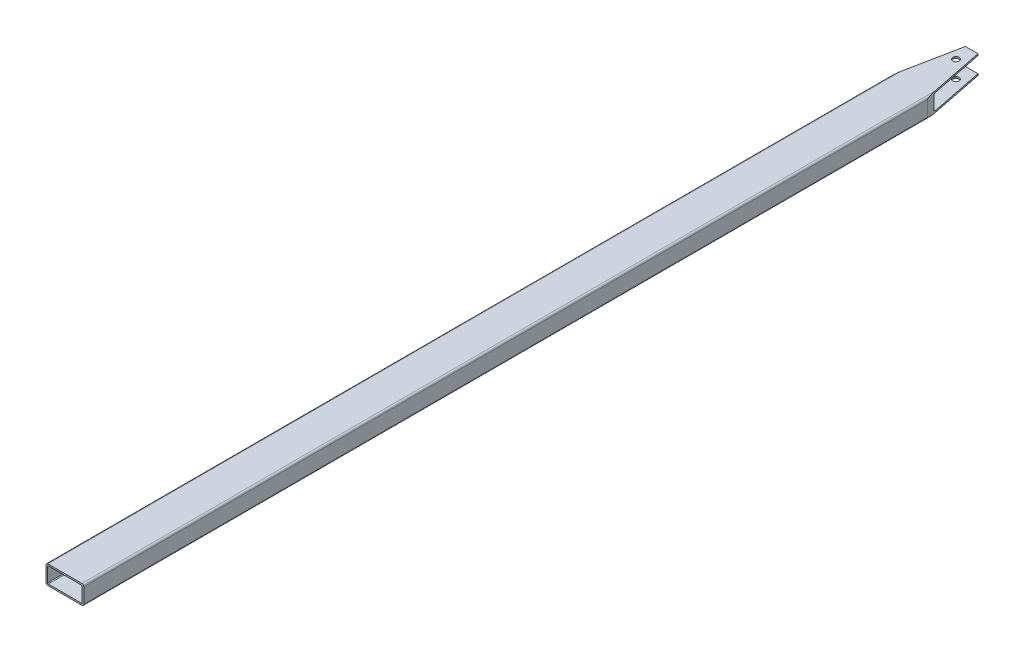
from build123d import *

# Parameters (mm, degrees)
BOSS_EXTRUDE1_DEPTH      = 914.4
BOSS_EXTRUDE1_DEPTH_BACK = 914.4
SKETCH7_R                = 6.35
CUT_EXTRUDE1_DEPTH       = 916.986124349


with BuildPart() as part:
    # Sketch4 → Boss-Extrude1 (new, two sides: drawn at the far end of the back side and taken through both)
    with BuildSketch(Plane.XY.offset(-BOSS_EXTRUDE1_DEPTH_BACK)):
        with BuildLine():
            Line((38.1, -15.24), (38.1, 15.24))
            ThreePointArc((38.1, 15.24), (36.984076836, 17.934076836), (34.29, 19.05))
            Line((34.29, 19.05), (-34.29, 19.05))
            ThreePointArc((-34.29, 19.05), (-36.984076836, 17.934076836), (-38.1, 15.24))
            Line((-38.1, 15.24), (-38.1, -15.24))
            ThreePointArc((-38.1, -15.24), (-36.984076836, -17.934076836), (-34.29, -19.05))
            Line((-34.29, -19.05), (34.29, -19.05))
            ThreePointArc((34.29, -19.05), (36.984076836, -17.934076836), (38.1, -15.24))
        make_face()
        with BuildLine():
            Line((34.925, 14.2875), (34.925, -14.2875))
            ThreePointArc((34.925, -14.2875), (34.460032015, -15.410032015), (33.3375, -15.875))
            Line((33.3375, -15.875), (-33.3375, -15.875))
            ThreePointArc((-33.3375, -15.875), (-34.460032015, -15.410032015), (-34.925, -14.2875))
            Line((-34.925, -14.2875), (-34.925, 14.2875))
            ThreePointArc((-34.925, 14.2875), (-34.460032015, 15.410032015), (-33.3375, 15.875))
            Line((-33.3375, 15.875), (33.3375, 15.875))
            ThreePointArc((33.3375, 15.875), (34.460032015, 15.410032015), (34.925, 14.2875))
        make_face(mode=Mode.SUBTRACT)
    extrude(amount=BOSS_EXTRUDE1_DEPTH + BOSS_EXTRUDE1_DEPTH_BACK)

    # Sketch7 → Cut-Extrude1 (cut, through all)
    with BuildSketch(Plane(origin=(0, 19.05, 0), x_dir=(1, 0, 0), z_dir=(0, 1, 0))):
        with Locations(Location((0, 882.65, 0), (0, 0, 270))):
            Circle(SKETCH7_R)
        Polygon((12.7, 914.4), (38.1, 787.4), (38.1, 914.4), align=None)
        Polygon((-12.7, 914.4), (-38.1, 914.4), (-38.1, 787.4), align=None)
    extrude(amount=-CUT_EXTRUDE1_DEPTH, mode=Mode.SUBTRACT)


solid = part.part
